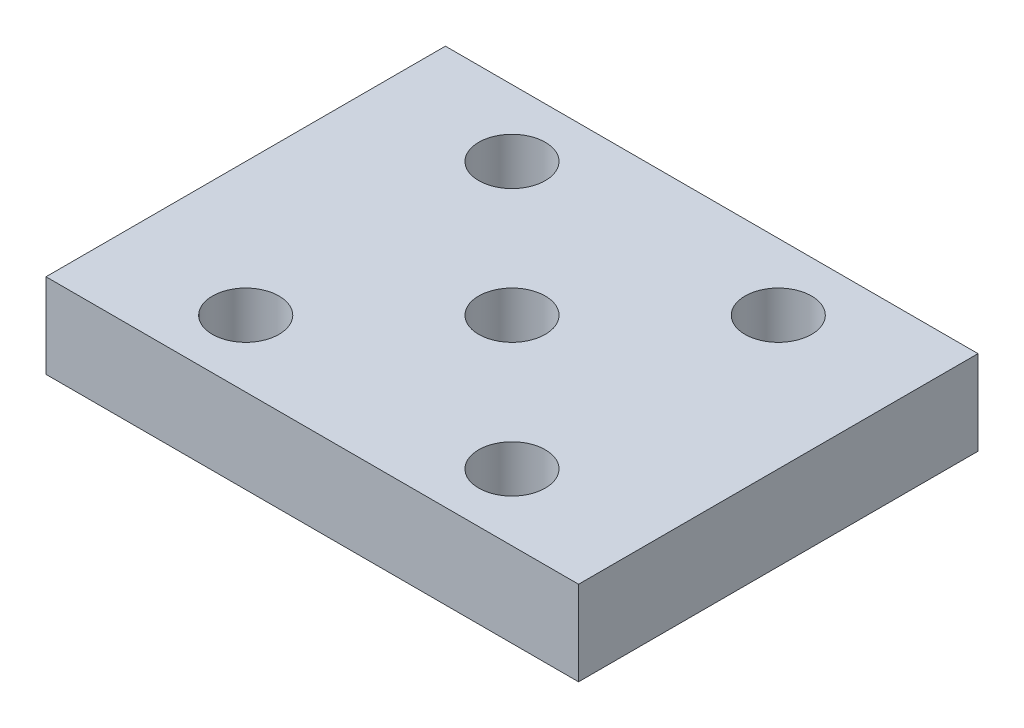
from build123d import *

# Parameters (mm, degrees)
SKETCH1_W           = 40
SKETCH1_H           = 30
SKETCH1_R           = 2.5
BOSS_EXTRUDE1_DEPTH = 3.175


with BuildPart() as part:
    # Sketch1 → Boss-Extrude1 (new, symmetric)
    with BuildSketch(Plane(origin=(0, 0, 0), x_dir=(1, 0, 0), z_dir=(0, 1, 0))):
        Rectangle(SKETCH1_W, SKETCH1_H)
        with Locations(Location((0, 0, 0), (0, 0, 270))):
            Circle(SKETCH1_R, mode=Mode.SUBTRACT)
        with Locations(Location((-10, 10, 0), (0, 0, 270))):
            Circle(SKETCH1_R, mode=Mode.SUBTRACT)
        with Locations(Location((10, 10, 0), (0, 0, 270))):
            Circle(SKETCH1_R, mode=Mode.SUBTRACT)
        with Locations(Location((10, -10, 0), (0, 0, 270))):
            Circle(SKETCH1_R, mode=Mode.SUBTRACT)
        with Locations(Location((-10, -10, 0), (0, 0, 270))):
            Circle(SKETCH1_R, mode=Mode.SUBTRACT)
    extrude(amount=BOSS_EXTRUDE1_DEPTH, both=True)


solid = part.part
